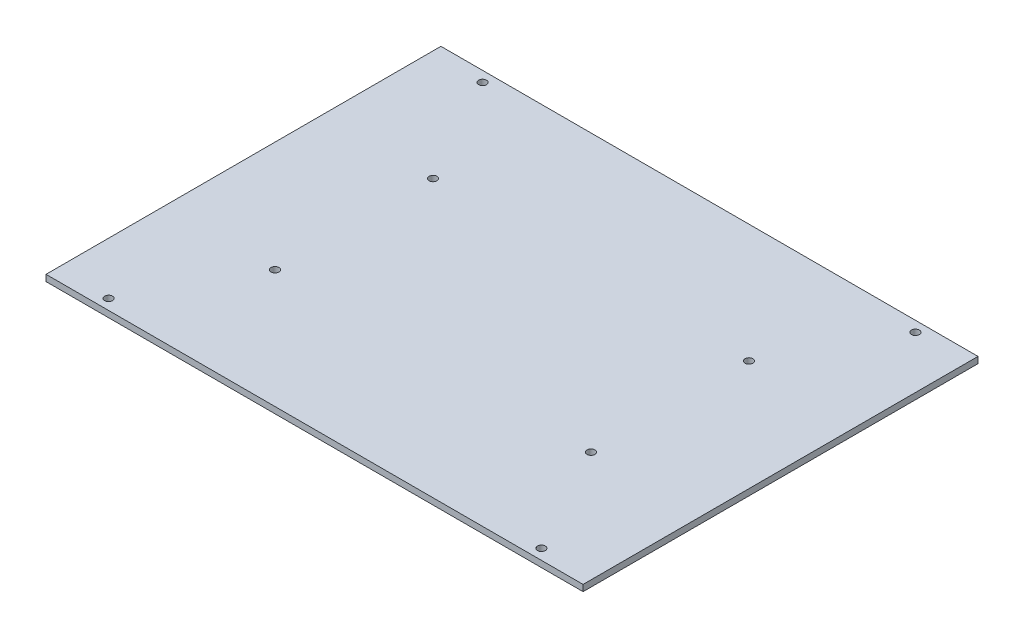
from build123d import *

# Parameters (mm, degrees)
ESQUISSE1_W                               = 170
ESQUISSE1_H                               = 125
BOSS_EXTRU_1_DEPTH                        = 2
TROU_POUR_TARAUDAGE_POUR_TROU_TARAUD_M3_D = 2.5


with BuildPart() as part:
    # Esquisse1 → Boss.-Extru.1 (new body)
    with BuildSketch(Plane(origin=(0, 0, 0), x_dir=(1, 0, 0), z_dir=(0, 1, 0))):
        Rectangle(ESQUISSE1_W, ESQUISSE1_H)
    extrude(amount=BOSS_EXTRU_1_DEPTH)

    # Trou pour taraudage pour trou taraudé M3x0.51 (through all)
    with Locations(Plane(origin=(0, 2, 0), x_dir=(1, 0, 0), z_dir=(0, 1, 0))):
        with Locations((-50, 25), (50, 25), (50, -25), (-50, -25), (68.5, 59.2), (-68.5, -59.2), (-68.5, 59.2), (68.5, -59.2)):
            Hole(TROU_POUR_TARAUDAGE_POUR_TROU_TARAUD_M3_D / 2)


solid = part.part
